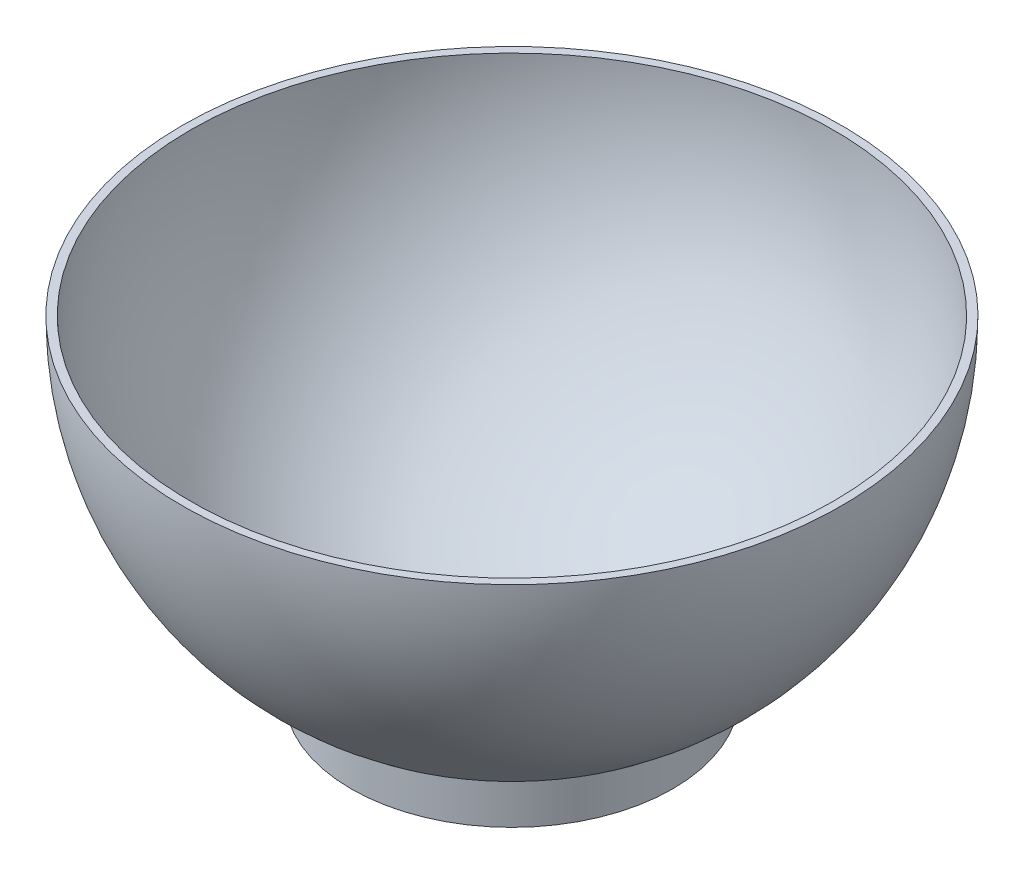
from build123d import *


with BuildPart() as part:
    # Sketch1 → Revolve1 (revolve)
    with BuildSketch(Plane.XY, mode=Mode.PRIVATE) as revolve1_sk:
        with BuildLine():
            Line((0, 0), (0, -3.175))
            ThreePointArc((0, -3.175), (92.047625241, 34.952374759), (130.175, 127))
            Line((130.175, 127), (127, 127))
            ThreePointArc((127, 127), (89.802561211, 37.197438789), (0, 0))
        make_face()
        with BuildLine():
            ThreePointArc((63.5, 13.363383432), (32.809176028, 1.027429202), (0, -3.175))
            Line((0, -3.175), (63.5, -3.175))
            Line((63.5, -3.175), (63.5, 13.363383432))
        make_face()
    revolve(revolve1_sk.sketch.rotate(Axis((0, 0, 0), (0, -1, 0)), 180), axis=Axis((0, 0, 0), (0, -1, 0)))


solid = part.part
